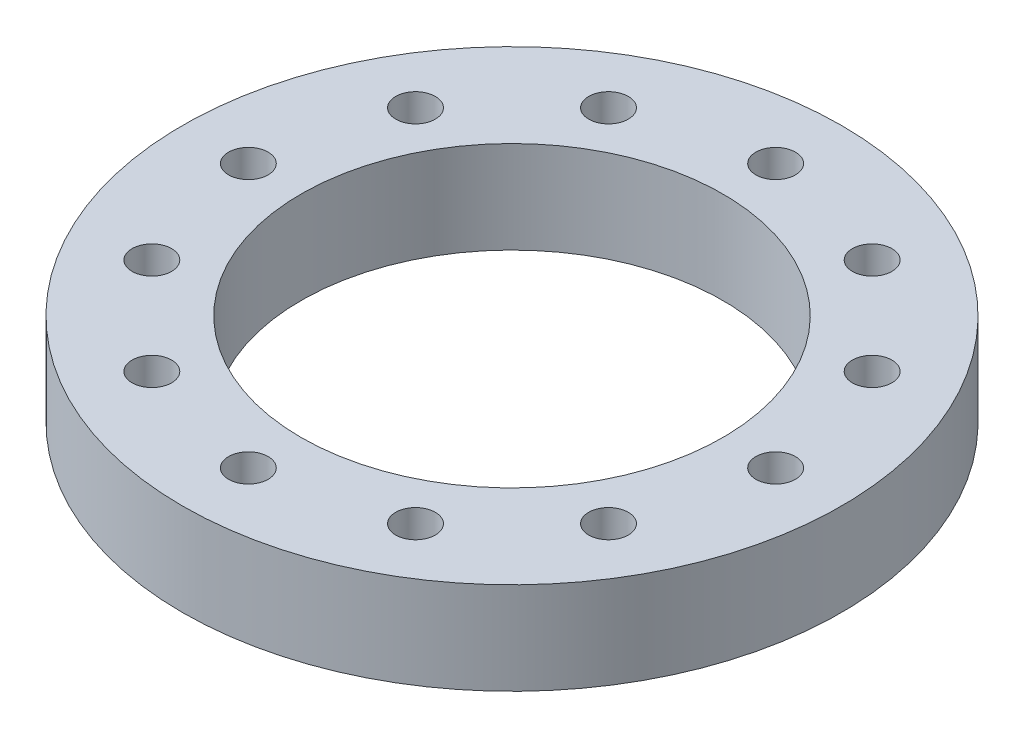
from build123d import *

# Parameters (mm, degrees)
SKETCH_1_R      = 25
SKETCH_1_R_2    = 16
SKETCH_1_R_3    = 1.5
EXTRUDE_1_DEPTH = 7


with BuildPart() as part:
    # 草图1 → 凸台-拉伸1 (new body)
    with BuildSketch(Plane(origin=(0, 0, 0), x_dir=(1, 0, 0), z_dir=(0, 1, 0))):
        with Locations(Location((0, 0, 0), (0, 0, 270))):
            Circle(SKETCH_1_R)
        with Locations(Location((0, 0, 0), (0, 0, 270))):
            Circle(SKETCH_1_R_2, mode=Mode.SUBTRACT)
        with Locations(Location((0, 20, 0), (0, 0, 270))):
            Circle(SKETCH_1_R_3, mode=Mode.SUBTRACT)
        with Locations(Location((10, 17.320508076, 0), (0, 0, 270))):
            Circle(SKETCH_1_R_3, mode=Mode.SUBTRACT)
        with Locations(Location((17.320508076, 10, 0), (0, 0, 270))):
            Circle(SKETCH_1_R_3, mode=Mode.SUBTRACT)
        with Locations(Location((20, 0, 0), (0, 0, 270))):
            Circle(SKETCH_1_R_3, mode=Mode.SUBTRACT)
        with Locations(Location((17.320508076, -10, 0), (0, 0, 270))):
            Circle(SKETCH_1_R_3, mode=Mode.SUBTRACT)
        with Locations(Location((10, -17.320508076, 0), (0, 0, 270))):
            Circle(SKETCH_1_R_3, mode=Mode.SUBTRACT)
        with Locations(Location((0, -20, 0), (0, 0, 270))):
            Circle(SKETCH_1_R_3, mode=Mode.SUBTRACT)
        with Locations(Location((-10, -17.320508076, 0), (0, 0, 270))):
            Circle(SKETCH_1_R_3, mode=Mode.SUBTRACT)
        with Locations(Location((-17.320508076, -10, 0), (0, 0, 270))):
            Circle(SKETCH_1_R_3, mode=Mode.SUBTRACT)
        with Locations(Location((-20, 0, 0), (0, 0, 270))):
            Circle(SKETCH_1_R_3, mode=Mode.SUBTRACT)
        with Locations(Location((-17.320508076, 10, 0), (0, 0, 270))):
            Circle(SKETCH_1_R_3, mode=Mode.SUBTRACT)
        with Locations(Location((-10, 17.320508076, 0), (0, 0, 270))):
            Circle(SKETCH_1_R_3, mode=Mode.SUBTRACT)
    extrude(amount=EXTRUDE_1_DEPTH)


solid = part.part
